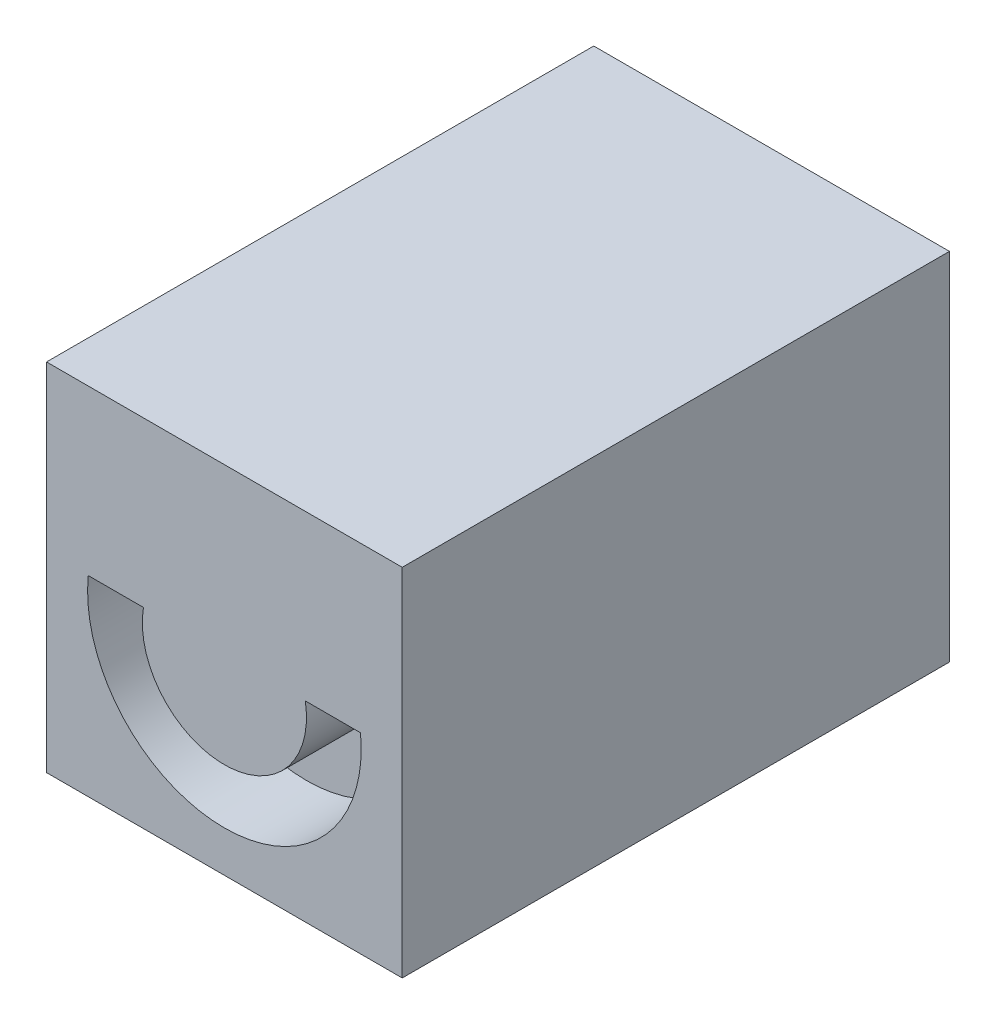
from build123d import *

# Parameters (mm, degrees)
SKETCH_4_W      = 130
SKETCH_4_H      = 130
EXTRUDE_1_DEPTH = 200
SKETCH_5_W      = 130
SKETCH_5_H      = 130
EXTRUDE_2_DEPTH = 170


with BuildPart() as part:
    # 스케치4 → 보스-돌출1 (new body)
    with BuildSketch(Plane.XY):
        Rectangle(SKETCH_4_W, SKETCH_4_H)
        with BuildLine():
            Line((-49.749371855, 5), (-29.580398915, 5))
            ThreePointArc((-29.580398915, 5), (0, -30), (29.580398915, 5))
            Line((29.580398915, 5), (49.749371855, 5))
            ThreePointArc((49.749371855, 5), (0, -50), (-49.749371855, 5))
        make_face(mode=Mode.SUBTRACT)
    extrude(amount=EXTRUDE_1_DEPTH)

    # 스케치5 → 보스-돌출2 (add)
    with BuildSketch(Plane(origin=(0, 0, 0), x_dir=(-1, 0, 0), z_dir=(0, 0, -1))):
        Rectangle(SKETCH_5_W, SKETCH_5_H)
    extrude(amount=-EXTRUDE_2_DEPTH)


solid = part.part
